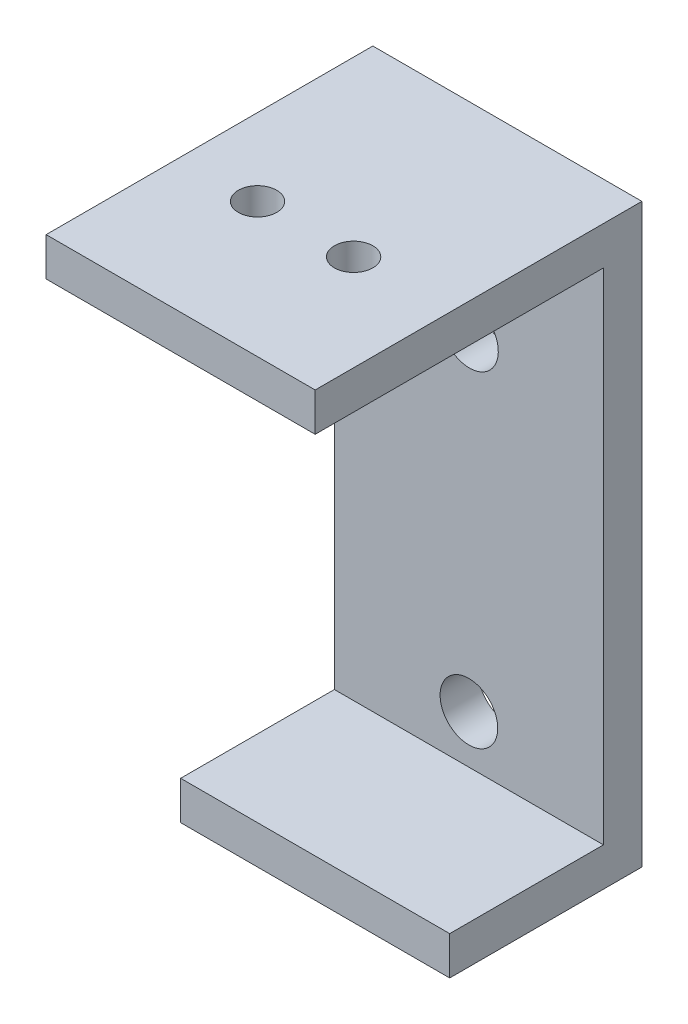
from build123d import *

# Parameters (mm, degrees)
EXTRUDE_1_DEPTH     = 14
SKETCH_5_R          = 1.5
CUT_EXTRUDE_1_DEPTH = 14
SKETCH_6_R          = 1
CUT_EXTRUDE_2_DEPTH = 14


with BuildPart() as part:
    # 草图1 → 凸台-拉伸1 (new body)
    with BuildSketch(Plane(origin=(0, 0, 0), x_dir=(0, 0, -1), z_dir=(1, 0, 0))):
        Polygon((0, 0), (10, 0), (10, 30), (-7, 30), (-7, 28), (8, 28), (8, 2), (0, 2), align=None)
    extrude(amount=EXTRUDE_1_DEPTH)

    # 草图5 → 切除-拉伸1 (cut)
    with BuildSketch(Plane(origin=(0, 0, -10), x_dir=(-1, 0, 0), z_dir=(0, 0, -1))):
        with Locations((-7.028963354, 21.5)):
            Circle(SKETCH_5_R)
        with Locations((-7, 4.5)):
            Circle(SKETCH_5_R)
    extrude(amount=-CUT_EXTRUDE_1_DEPTH, mode=Mode.SUBTRACT)

    # 草图6 → 切除-拉伸2 (cut)
    with BuildSketch(Plane(origin=(0, 30, 0), x_dir=(1, 0, 0), z_dir=(0, 1, 0))):
        with Locations(Location((4, 0, 0), (0, 0, 270))):
            Circle(SKETCH_6_R)
        with Locations(Location((9, 0, 0), (0, 0, 270))):
            Circle(SKETCH_6_R)
    extrude(amount=-CUT_EXTRUDE_2_DEPTH, mode=Mode.SUBTRACT)


solid = part.part
